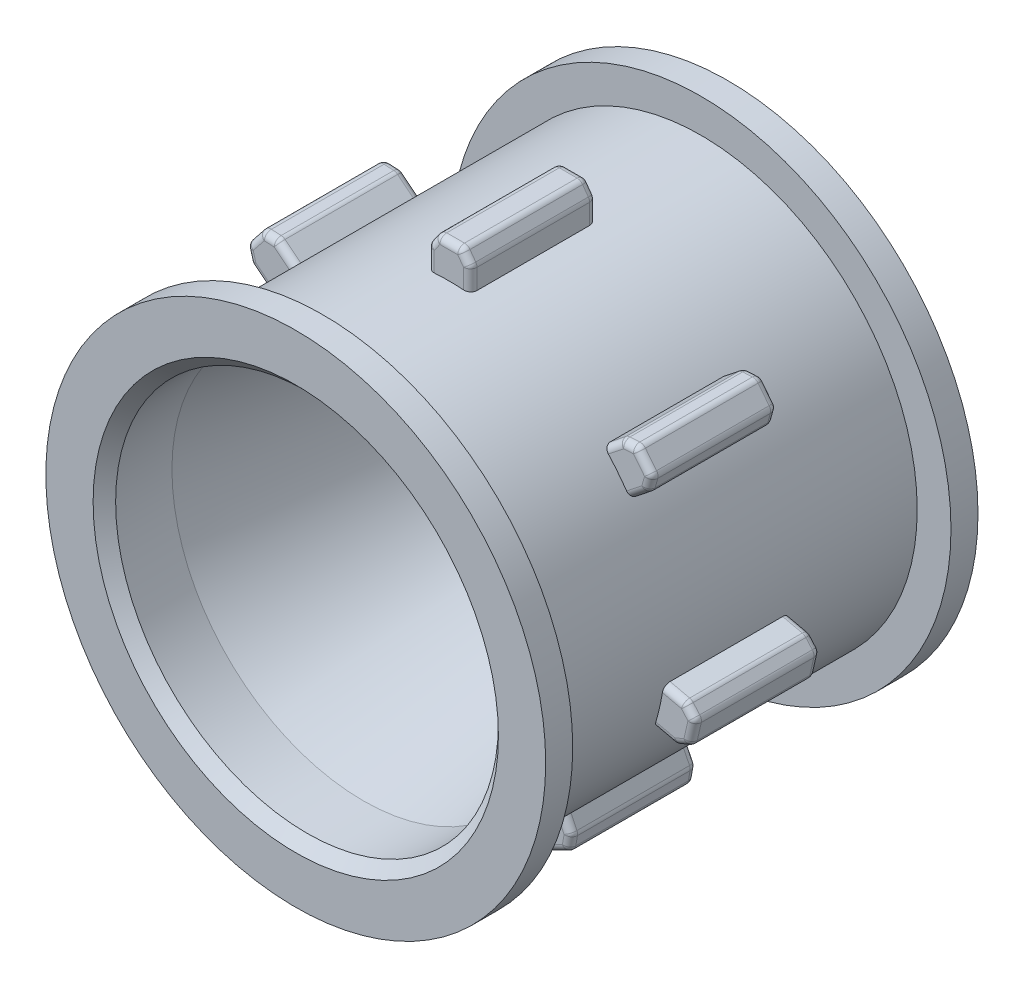
from build123d import *
from OCP.BRepFilletAPI import BRepFilletAPI_MakeChamfer

# Parameters (mm, degrees)
LAUFRAD_DEPTH                   = 8.4
LAUFRAD_DEPTH_BACK              = 8.4
SKIZZE1_R                       = 9.6
SKIZZE2_R                       = 11.1
KETTENF_HRUNG_DEPTH             = 1.2
SKIZZE4_R                       = 1
SCHRAUBENBOHRUNG_M3_DEPTH       = 25.800403223
SKIZZE3_R                       = 4.1
KUGELLAGERSITZ_DEPTH            = 2
FASE1_SIZE                      = 0.1
ZAHN_DEPTH                      = 2.8
VERRUNDUNG1_R                   = 0.3
KREISMUSTER1_COUNT              = 7
VERRUNDUNG1_OF_KREISMUSTER1_R   = 0.3
SKIZZE8_W                       = 4.2
SKIZZE8_H                       = 17.4
AUSCHNITT_ANTRIEB_WAGE_DEPTH    = 2
SKIZZE10_W                      = 17
SKIZZE10_H                      = 7.6
SCHNITT_LINEAR_AUSTRAGEN2_DEPTH = 2
FASE2_SIZE                      = 0.5
FASE2_SIZE2                     = 0.634496292


with BuildPart() as part:
    # Skizze1 → Laufrad (new, two sides: drawn at the far end of the back side and taken through both)
    with BuildSketch(Plane.XY.offset(-LAUFRAD_DEPTH_BACK)):
        Circle(SKIZZE1_R)
    extrude(amount=LAUFRAD_DEPTH + LAUFRAD_DEPTH_BACK)

    # Skizze2 → Kettenführung (add)
    with BuildSketch(Plane.XY.offset(8.4)):
        Circle(SKIZZE2_R)
    kettenf_hrung = extrude(amount=KETTENF_HRUNG_DEPTH)

    # Spiegeln Kettenführung: Kettenführung across plane
    add(kettenf_hrung.mirror(Plane.XY))

    # Skizze4 → SchraubenBohrung M3 (cut, through all)
    with BuildSketch(Plane(origin=(0, 0, -9.6), x_dir=(-1, 0, 0), z_dir=(0, 0, -1))):
        Circle(SKIZZE4_R)
    extrude(amount=-SCHRAUBENBOHRUNG_M3_DEPTH, mode=Mode.SUBTRACT)

    # Skizze3 → Kugellagersitz (cut)
    with BuildSketch(Plane(origin=(0, 0, -9.6), x_dir=(-1, 0, 0), z_dir=(0, 0, -1))):
        Circle(SKIZZE3_R)
    extrude(amount=-KUGELLAGERSITZ_DEPTH, mode=Mode.SUBTRACT)

    # Skizze5 → Schnitt-Rotation3 (revolve, cut)
    with BuildSketch(Plane(origin=(0, 0, 0), x_dir=(0, 0, -1), z_dir=(1, 0, 0))):
        Polygon((-9.6, 0), (-9.6, 8.5), (-6.6, 8.5), (6.1, 6), (6.1, 0), align=None)
    revolve(axis=Axis((0, 0, -8.4), (0, 0, 1)), mode=Mode.SUBTRACT)

    # Fase1
    fase1_edges = [part.edges().sort_by_distance(p)[0] for p in [
        (1, 0, -6.1),
    ]]
    chamfer(fase1_edges, length=FASE1_SIZE)

    # Skizze6 → Zahn (add, symmetric)
    with BuildSketch(Plane.XY):
        Polygon((0.55, 11.1), (-0.55, 11.1), (-0.95, 10.542409848), (-0.95, 9.552879147), (0.95, 9.552879147), (0.95, 10.542409848), align=None)
    zahn = extrude(amount=ZAHN_DEPTH, both=True)

    # Verrundung1
    verrundung1_edges = [part.edges().sort_by_distance(p)[0] for p in [
        (0.95, 10.542409848, 0),
        (-0.95, 10.542409848, 0),
        (-0.95, 10.047644498, -2.8),
        (-0.75, 10.821204924, -2.8),
        (0, 11.1, -2.8),
        (0.75, 10.821204924, -2.8),
        (0.95, 10.047644498, -2.8),
        (-0.55, 11.1, 0),
        (0.55, 11.1, 0),
        (-0.95, 10.047644498, 2.8),
        (-0.75, 10.821204924, 2.8),
        (0, 11.1, 2.8),
        (0.75, 10.821204924, 2.8),
        (0.95, 10.047644498, 2.8),
    ]]
    fillet(verrundung1_edges, radius=VERRUNDUNG1_R)

    # Kreismuster1: Zahn ×7 about axis
    kreismuster1_axis = Axis((0, 0, -8.4), (0, 0, 1))
    for i in range(1, KREISMUSTER1_COUNT):
        add(zahn.rotate(kreismuster1_axis, i * 360 / KREISMUSTER1_COUNT))

    # Verrundung1 of Kreismuster1
    verrundung1_of_kreismuster1_edges = [part.edges().sort_by_distance(p)[0] for p in [
        (-7.650072609, 7.315824936, 0),
        (-8.834703232, 5.830345119, 0),
        (-8.447880105, 5.521863969, -2.8),
        (-8.927976039, 6.160537302, -2.8),
        (-8.678329455, 6.920736801, -2.8),
        (-7.992741337, 7.333284526, -2.8),
        (-7.263249481, 7.007343785, -2.8),
        (-9.021248846, 6.490729485, 0),
        (-8.335410064, 7.350744116, 0),
        (-8.447880105, 5.521863969, 2.8),
        (-8.927976039, 6.160537302, 2.8),
        (-8.678329455, 6.920736801, 2.8),
        (-7.992741337, 7.333284526, 2.8),
        (-7.263249481, 7.007343785, 2.8),
        (-10.48948451, -1.419725369, 0),
        (-10.066694735, -3.272088402, 0),
        (-9.584334185, -3.161992754, -2.8),
        (-10.383004023, -3.13914056, -2.8),
        (-10.821699825, -2.469982367, -2.8),
        (-10.716785424, -1.676748692, -2.8),
        (-10.00712396, -1.309629721, -2.8),
        (-10.699313312, -3.006192719, 0),
        (-10.944086339, -1.933772015, 0),
        (-9.584334185, -3.161992754, 2.8),
        (-10.383004023, -3.13914056, 2.8),
        (-10.821699825, -2.469982367, 2.8),
        (-10.716785424, -1.676748692, 2.8),
        (-10.00712396, -1.309629721, 2.8),
        (-5.430100629, -9.086193514, 0),
        (-3.71825978, -9.910572618, 0),
        (-3.503589139, -9.46480444, -2.8),
        (-4.019418203, -10.074981554, -2.8),
        (-4.816109504, -10.000754434, -2.8),
        (-5.370871505, -9.424155945, -2.8),
        (-5.215429988, -8.640425336, -2.8),
        (-4.320576627, -10.23939049, 0),
        (-5.311642382, -9.762118377, 0),
        (-3.503589139, -9.46480444, 2.8),
        (-4.019418203, -10.074981554, 2.8),
        (-4.816109504, -10.000754434, 2.8),
        (-5.370871505, -9.424155945, 2.8),
        (-5.215429988, -8.640425336, 2.8),
        (3.71825978, -9.910572618, 0),
        (5.430100629, -9.086193514, 0),
        (5.215429988, -8.640425336, -2.8),
        (5.370871505, -9.424155945, -2.8),
        (4.816109504, -10.000754434, -2.8),
        (4.019418203, -10.074981554, -2.8),
        (3.503589139, -9.46480444, -2.8),
        (5.311642382, -9.762118377, 0),
        (4.320576627, -10.23939049, 0),
        (5.215429988, -8.640425336, 2.8),
        (5.370871505, -9.424155945, 2.8),
        (4.816109504, -10.000754434, 2.8),
        (4.019418203, -10.074981554, 2.8),
        (3.503589139, -9.46480444, 2.8),
        (10.066694735, -3.272088402, 0),
        (10.48948451, -1.419725369, 0),
        (10.00712396, -1.309629721, -2.8),
        (10.716785424, -1.676748692, -2.8),
        (10.821699825, -2.469982367, -2.8),
        (10.383004023, -3.13914056, -2.8),
        (9.584334185, -3.161992754, -2.8),
        (10.944086339, -1.933772015, 0),
        (10.699313312, -3.006192719, 0),
        (10.00712396, -1.309629721, 2.8),
        (10.716785424, -1.676748692, 2.8),
        (10.821699825, -2.469982367, 2.8),
        (10.383004023, -3.13914056, 2.8),
        (9.584334185, -3.161992754, 2.8),
        (8.834703232, 5.830345119, 0),
        (7.650072609, 7.315824936, 0),
        (7.263249481, 7.007343785, -2.8),
        (7.992741337, 7.333284526, -2.8),
        (8.678329455, 6.920736801, -2.8),
        (8.927976039, 6.160537302, -2.8),
        (8.447880105, 5.521863969, -2.8),
        (8.335410064, 7.350744116, 0),
        (9.021248846, 6.490729485, 0),
        (7.263249481, 7.007343785, 2.8),
        (7.992741337, 7.333284526, 2.8),
        (8.678329455, 6.920736801, 2.8),
        (8.927976039, 6.160537302, 2.8),
        (8.447880105, 5.521863969, 2.8),
    ]]
    fillet(verrundung1_of_kreismuster1_edges, radius=VERRUNDUNG1_OF_KREISMUSTER1_R)

    # Skizze8 → Auschnitt Antrieb Wage (cut)
    with BuildSketch(Plane(origin=(0, 0, -9.6), x_dir=(-1, 0, 0), z_dir=(0, 0, -1))):
        Rectangle(SKIZZE8_W, SKIZZE8_H)
    extrude(amount=-AUSCHNITT_ANTRIEB_WAGE_DEPTH, mode=Mode.SUBTRACT)

    # Skizze10 → Schnitt-Linear austragen2 (cut)
    with BuildSketch(Plane(origin=(0, 0, -9.6), x_dir=(-1, 0, 0), z_dir=(0, 0, -1))):
        Rectangle(SKIZZE10_W, SKIZZE10_H)
    extrude(amount=-SCHNITT_LINEAR_AUSTRAGEN2_DEPTH, mode=Mode.SUBTRACT)

    # Fase2: one chamfer whose edges measure the first distance from different faces: ONE call of the kernel's chamfer builder (chamfer() names one face for all edges)
    fase2_edges_1 = [part.edges().sort_by_distance(p)[0] for p in [
        (0, -6, -6.1),
    ]]
    fase2_side_1 = [part.faces().sort_by_distance(p)[0] for p in [
        (1.269705627, 0, -6.1),
    ]]
    fase2_edges_2 = [part.edges().sort_by_distance(p)[0] for p in [
        (0, -8.5, 9.6),
    ]]
    fase2 = BRepFilletAPI_MakeChamfer(part.part.solid().wrapped)
    for e in fase2_edges_1:
        fase2.Add(FASE2_SIZE, FASE2_SIZE2, e.wrapped, fase2_side_1[0].wrapped)  # the first distance lies on this face
    for e in fase2_edges_2:
        fase2.Add(FASE2_SIZE, e.wrapped)
    add(Compound.cast(fase2.Shape()), mode=Mode.REPLACE)


solid = part.part
